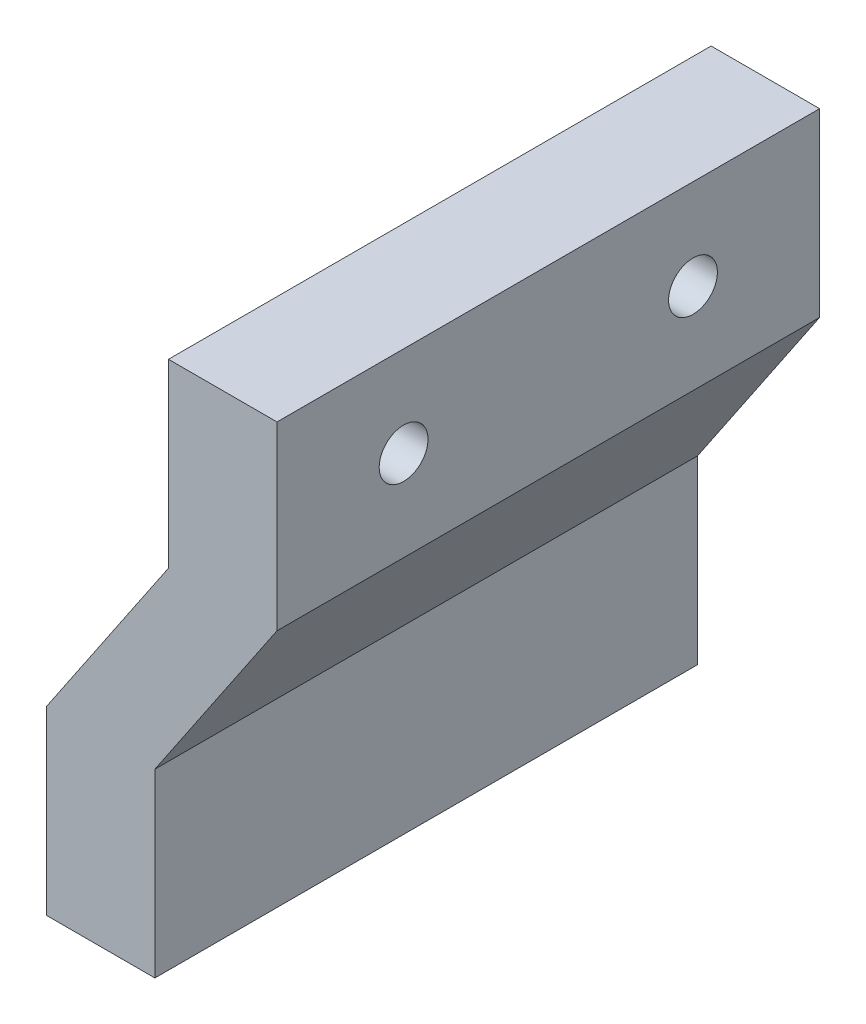
from build123d import *

# Parameters (mm, degrees)
BOSS_EXTRUDE1_DEPTH = 30
SKETCH2_R           = 1.35
CUT_EXTRUDE1_DEPTH  = 8.5
CUT_EXTRUDE2_REACH  = 44.96
SKETCH3_R           = 1.35


with BuildPart() as part:
    # Sketch1 → Boss-Extrude1 (new body)
    with BuildSketch(Plane.XY):
        Polygon((0, 0), (6, 0), (6, 10), (12.75, 20), (12.75, 30), (6.75, 30), (6.75, 20), (0, 10), align=None)
    extrude(amount=BOSS_EXTRUDE1_DEPTH)

    # Sketch2 → Cut-Extrude1 (cut)
    with BuildSketch(Plane.XZ):
        with Locations(Location((3, 26.5, 0), (0, 0, 270))):
            Circle(SKETCH2_R)
        with Locations(Location((3, 3.5, 0), (0, 0, 270))):
            Circle(SKETCH2_R)
    extrude(amount=-CUT_EXTRUDE1_DEPTH, mode=Mode.SUBTRACT)

    # Sketch3 → Cut-Extrude2 (cut, up to next)
    with BuildSketch(Plane.ZY.offset(-6.75), mode=Mode.PRIVATE) as cut_extrude2_sk1:
        with Locations(Location((7, 25, 0), (0, 0, 270))):
            Circle(SKETCH3_R)
    cut_extrude2_tool1 = extrude(cut_extrude2_sk1.sketch, amount=-CUT_EXTRUDE2_REACH, mode=Mode.PRIVATE) & part.part
    # Sketch3 → Cut-Extrude2 (cut, up to next)
    with BuildSketch(Plane.ZY.offset(-6.75), mode=Mode.PRIVATE) as cut_extrude2_sk2:
        with Locations(Location((23, 25, 0), (0, 0, 270))):
            Circle(SKETCH3_R)
    cut_extrude2_tool2 = extrude(cut_extrude2_sk2.sketch, amount=-CUT_EXTRUDE2_REACH, mode=Mode.PRIVATE) & part.part
    add(cut_extrude2_tool1.solids().sort_by_distance((6.75, 25, 7))[0], mode=Mode.SUBTRACT)
    add(cut_extrude2_tool2.solids().sort_by_distance((6.75, 25, 23))[0], mode=Mode.SUBTRACT)


solid = part.part
